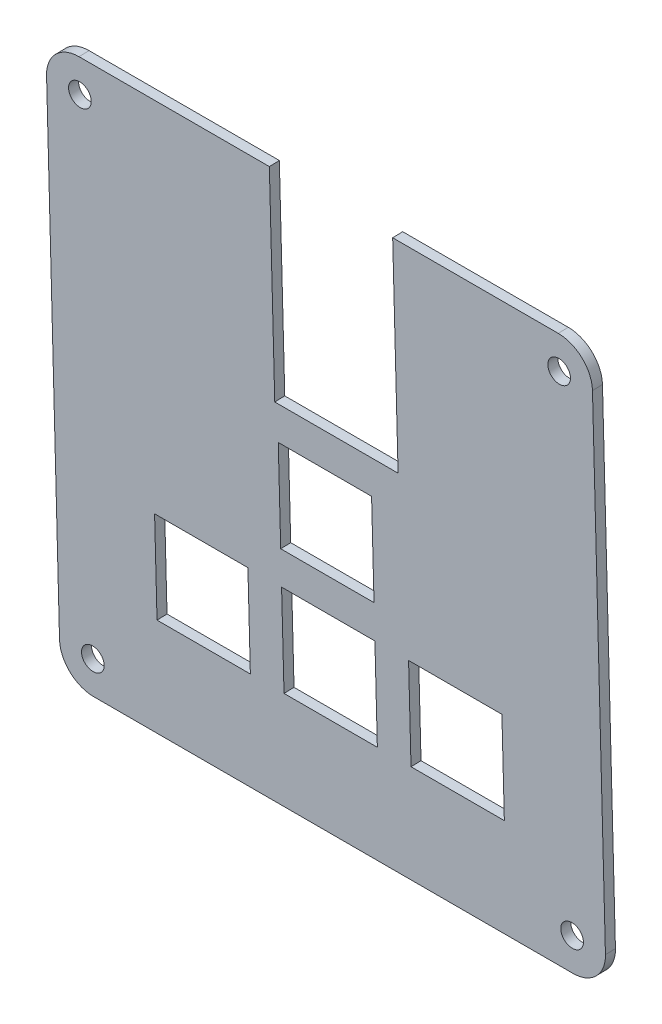
from build123d import *

# Parameters (mm, degrees)
SKETCH2_R             = 1.7
BOSS_EXTRUDE3_DEPTH   = 1.5
FILLET4_R             = 5
BODY_MOVE_COPY1_ANGLE = 91.5
BODY_MOVE_COPY2_ANGLE = 180
SKETCH3_W             = 14
SKETCH3_H             = 14
CUT_EXTRUDE6_DEPTH    = 10


with BuildPart() as part:
    # Sketch2 → Boss-Extrude3 (new body)
    with BuildSketch(Plane(origin=(0, 0, 0), x_dir=(1, 0, 0), z_dir=(0, 1, 0))):
        Polygon((41.198193182, -31.056403409), (41.198193182, 53.223596591), (7.648193182, 53.223596591), (7.648193182, 22.223596591), (-10.851806818, 22.223596591), (-10.851806818, 53.223596591), (-40.691806818, 53.223596591), (-40.691806818, -31.056403409), align=None)
        with Locations((-35.691806818, -26.056403409)):
            Circle(SKETCH2_R, mode=Mode.SUBTRACT)
        with Locations((36.198193182, -26.056403409)):
            Circle(SKETCH2_R, mode=Mode.SUBTRACT)
        with Locations((-35.691806818, 48.223596591)):
            Circle(SKETCH2_R, mode=Mode.SUBTRACT)
        with Locations((36.198193182, 48.223596591)):
            Circle(SKETCH2_R, mode=Mode.SUBTRACT)
    extrude(amount=BOSS_EXTRUDE3_DEPTH)

    # Fillet4
    fillet4_edges = [part.edges().sort_by_distance(p)[0] for p in [
        (-40.691806818, 0.75, 31.056403409),
        (41.198193182, 0.75, 31.056403409),
        (41.198193182, 0.75, -53.223596591),
        (-40.691806818, 0.75, -53.223596591),
    ]]
    fillet(fillet4_edges, radius=FILLET4_R)


with BuildPart() as part_1:
    # Body-Move/Copy1: moved
    add(part.part.rotate(Axis((0, 0.75, -12.283596591), (-1, 0, 0)), BODY_MOVE_COPY1_ANGLE))


with BuildPart() as part_2:
    # Body-Move/Copy2: moved
    add(part_1.part.rotate(Axis((0.403193182, 0.75, 0), (0, 0, 1)), BODY_MOVE_COPY2_ANGLE))

    # Sketch3 → Cut-Extrude6 (cut)
    with BuildSketch(Plane(origin=(0, 0.341583523, -13.044548447), x_dir=(-1, 0, 0), z_dir=(-2.1436792936287095e-13, 0.026176948305881326, -0.9996573249756094))):
        with Locations((-19.598193182, -20.81180408)):
            Rectangle(SKETCH3_W, SKETCH3_H)
        with Locations((-0.548193182, -20.81180408)):
            Rectangle(SKETCH3_W, SKETCH3_H)
        with Locations((18.501806818, -20.81180408)):
            Rectangle(SKETCH3_W, SKETCH3_H)
        with Locations((-0.548193182, -1.76180408)):
            Rectangle(SKETCH3_W, SKETCH3_H)
    extrude(amount=-CUT_EXTRUDE6_DEPTH, mode=Mode.SUBTRACT)


solid = part_2.part
